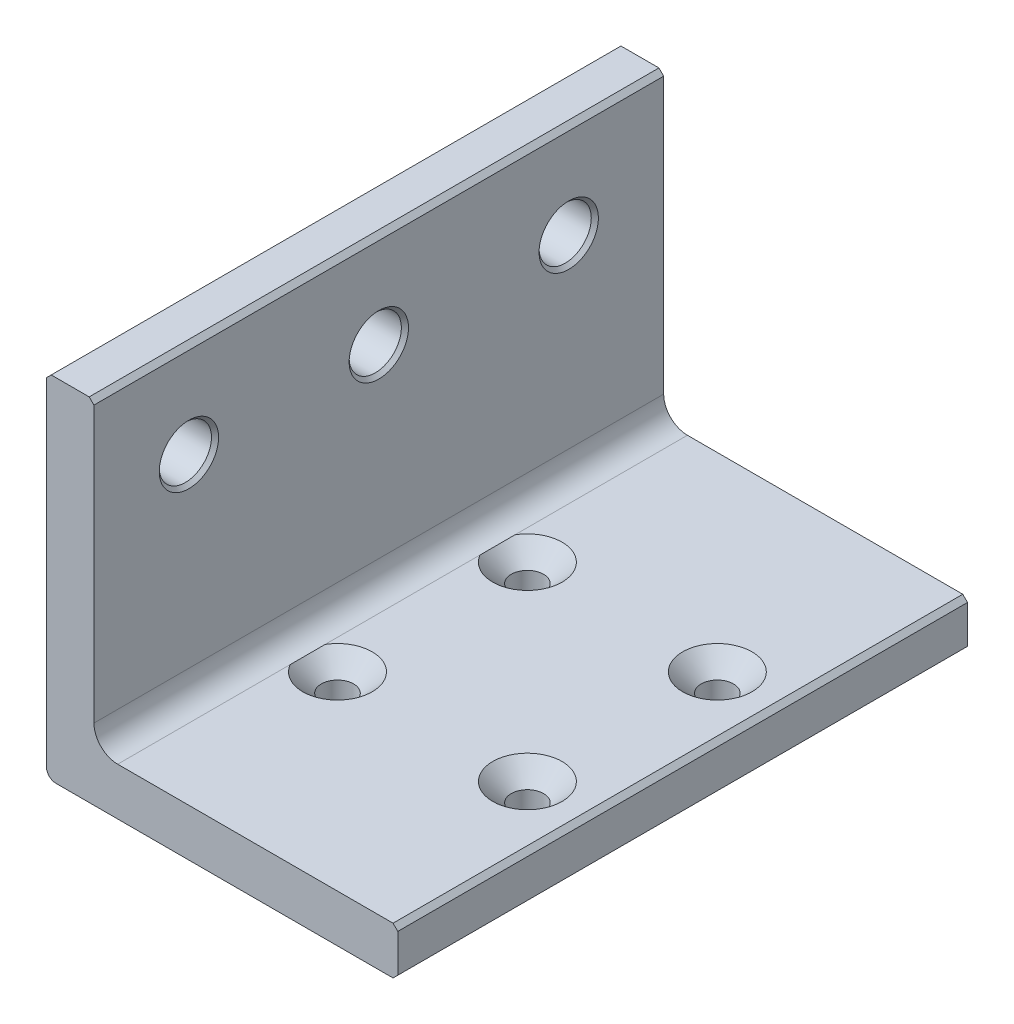
from build123d import *

# Parameters (mm, degrees)
BOSS_EXTRUDE1_DEPTH                            = 60
CSK_FOR_M3_FLAT_HEAD_MACHINE_SCREW1_AT_2_COUNT = 2
CSK_FOR_M3_FLAT_HEAD_MACHINE_SCREW1_AT_2_PITCH = 20
CSK_FOR_M3_FLAT_HEAD_MACHINE_SCREW1_AT_3_COUNT = 2
CSK_FOR_M3_FLAT_HEAD_MACHINE_SCREW1_AT_3_PITCH = 28.284271247
CSK_FOR_M3_FLAT_HEAD_MACHINE_SCREW1_AT_4_COUNT = 2
CSK_FOR_M3_FLAT_HEAD_MACHINE_SCREW1_AT_4_PITCH = 20
M5_CLEARANCE_HOLE1_AT_2_COUNT                  = 2
M5_CLEARANCE_HOLE1_AT_2_PITCH                  = 20
M5_CLEARANCE_HOLE1_AT_3_COUNT                  = 2
M5_CLEARANCE_HOLE1_AT_3_PITCH                  = 40


with BuildPart() as part:
    # Sketch1 → Boss-Extrude1 (new body)
    with BuildSketch(Plane.XY):
        with BuildLine():
            Line((-21.945528184, 16.707726181), (-21.945528184, -18.792273819))
            ThreePointArc((-21.945528184, -18.792273819), (-21.652634965, -19.4993806), (-20.945528184, -19.792273819))
            Line((-20.945528184, -19.792273819), (14.554471816, -19.792273819))
            Line((14.554471816, -19.792273819), (15.054471816, -19.292273819))
            Line((15.054471816, -19.292273819), (15.054471816, -15.292273819))
            Line((15.054471816, -15.292273819), (14.554471816, -14.792273819))
            Line((14.554471816, -14.792273819), (-14.445528184, -14.792273819))
            ThreePointArc((-14.445528184, -14.792273819), (-16.213295137, -14.060040772), (-16.945528184, -12.292273819))
            Line((-16.945528184, -12.292273819), (-16.945528184, 16.707726181))
            Line((-16.945528184, 16.707726181), (-17.445528184, 17.207726181))
            Line((-17.445528184, 17.207726181), (-21.445528184, 17.207726181))
            Line((-21.445528184, 17.207726181), (-21.945528184, 16.707726181))
        make_face()
    extrude(amount=BOSS_EXTRUDE1_DEPTH)

    # Sketch3 → CSK for M3 Flat Head Machine Screw1 (revolve, cut)
    with BuildSketch(Plane(origin=(-11.295528184, -14.792273819, 40), x_dir=(0, 0, 1), z_dir=(1, 0, 0))):
        Polygon((0, 0), (0, 5), (2, 5), (1.7, 4.7), (1.7, 1.95), (3.65, 0), align=None)
    csk_for_m3_flat_head_machine_screw1 = revolve(axis=Axis((-11.295528184, -8.442273819, 40), (0, -1, 0)), mode=Mode.SUBTRACT)

    # CSK for M3 Flat Head Machine Screw1 at 2: CSK for M3 Flat Head Machine Screw1 ×2
    with Locations(*[(i * CSK_FOR_M3_FLAT_HEAD_MACHINE_SCREW1_AT_2_PITCH, 0, 0) for i in range(1, CSK_FOR_M3_FLAT_HEAD_MACHINE_SCREW1_AT_2_COUNT)]):
        add(csk_for_m3_flat_head_machine_screw1, mode=Mode.SUBTRACT)

    # CSK for M3 Flat Head Machine Screw1 at 3: CSK for M3 Flat Head Machine Screw1 ×2
    with Locations(*[Vector(0.7071067811865475, 0, -0.7071067811865476) * (i * CSK_FOR_M3_FLAT_HEAD_MACHINE_SCREW1_AT_3_PITCH) for i in range(1, CSK_FOR_M3_FLAT_HEAD_MACHINE_SCREW1_AT_3_COUNT)]):
        add(csk_for_m3_flat_head_machine_screw1, mode=Mode.SUBTRACT)

    # CSK for M3 Flat Head Machine Screw1 at 4: CSK for M3 Flat Head Machine Screw1 ×2
    with Locations(*[(0, 0, -i * CSK_FOR_M3_FLAT_HEAD_MACHINE_SCREW1_AT_4_PITCH) for i in range(1, CSK_FOR_M3_FLAT_HEAD_MACHINE_SCREW1_AT_4_COUNT)]):
        add(csk_for_m3_flat_head_machine_screw1, mode=Mode.SUBTRACT)

    # Sketch5 → M5 Clearance Hole1 (revolve, cut)
    with BuildSketch(Plane(origin=(-16.945528184, 7.207726181, 50), x_dir=(0, 0, -1), z_dir=(0, 1, 0))):
        Polygon((0, 0), (0, 5), (3.125, 5), (2.75, 4.625), (2.75, 0.375), (3.125, 0), align=None)
    m5_clearance_hole1 = revolve(axis=Axis((-10.595528184, 7.207726181, 50), (-1, 0, 0)), mode=Mode.SUBTRACT)

    # M5 Clearance Hole1 at 2: M5 Clearance Hole1 ×2
    with Locations(*[(0, 0, -i * M5_CLEARANCE_HOLE1_AT_2_PITCH) for i in range(1, M5_CLEARANCE_HOLE1_AT_2_COUNT)]):
        add(m5_clearance_hole1, mode=Mode.SUBTRACT)

    # M5 Clearance Hole1 at 3: M5 Clearance Hole1 ×2
    with Locations(*[(0, 0, -i * M5_CLEARANCE_HOLE1_AT_3_PITCH) for i in range(1, M5_CLEARANCE_HOLE1_AT_3_COUNT)]):
        add(m5_clearance_hole1, mode=Mode.SUBTRACT)


solid = part.part
